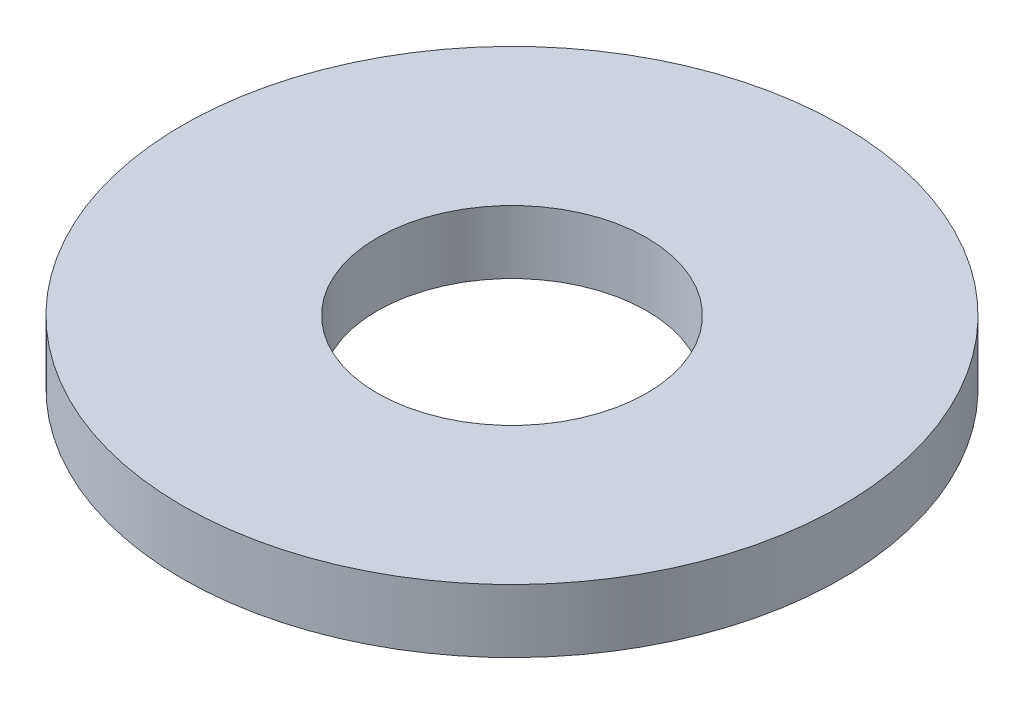
from build123d import *

# Parameters (mm, degrees)
SKETCH1_R           = 17.4625
BOSS_EXTRUDE1_DEPTH = 3.3528
SKETCH5_R           = 7.1374
CUT_EXTRUDE1_DEPTH  = 25.922260739


with BuildPart() as part:
    # Sketch1 → Boss-Extrude1 (new body)
    with BuildSketch(Plane(origin=(0, 0, 0), x_dir=(1, 0, 0), z_dir=(0, 1, 0))):
        with Locations(Location((0, 0, 0), (0, 0, 270))):
            Circle(SKETCH1_R)
    extrude(amount=BOSS_EXTRUDE1_DEPTH)

    # Sketch5 → Cut-Extrude1 (cut, through all)
    with BuildSketch(Plane(origin=(0, 3.3528, 0), x_dir=(-1, 0, 0), z_dir=(0, 1, 0))):
        with Locations(Location((0, 0, 0), (0, 0, 90))):
            Circle(SKETCH5_R)
    extrude(amount=-CUT_EXTRUDE1_DEPTH, mode=Mode.SUBTRACT)


solid = part.part
